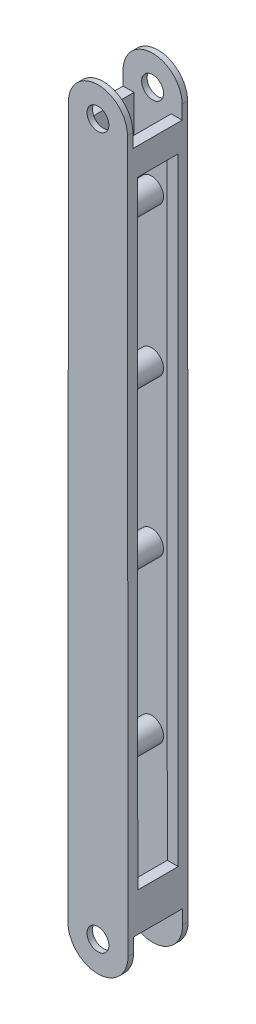
from build123d import *

# Parameters (mm, degrees)
SKETCH1_R               = 10
BOSS_EXTRUDE2_DEPTH     = 5
BOSS_EXTRUDE3_DEPTH     = 55
BOSS_EXTRUDE4_START     = 50
SKETCH1_4_R             = 10
BOSS_EXTRUDE4_DEPTH     = 5
CUT_EXTRUDE1_DEPTH      = 682.432576538
CUT_EXTRUDE1_DEPTH_BACK = 682.432576538
SKETCH3_W               = 37
SKETCH3_H               = 564.316545641
SKETCH4_R               = 11
BOSS_EXTRUDE5_DEPTH     = 49


with BuildPart() as part:
    # Sketch1 → Boss-Extrude2 (new body)
    with BuildSketch(Plane.XY):
        with BuildLine():
            Line((27.00967764, 637.419067567), (27, 650))
            ThreePointArc((27, 650), (11.628325989, 674.367643191), (-16.983854422, 670.989251749))
            ThreePointArc((-16.983854422, 670.989251749), (-24.367643191, 661.628325989), (-27, 650))
            Line((-27, 650), (-27.00967764, 637.419067567))
            Line((-27.00967764, 637.419067567), (-17.00967764, 637.419067567))
            Line((-17.00967764, 637.419067567), (-17.490017949, 12.976666451))
            Line((-17.490017949, 12.976666451), (-27.490017949, 12.976666451))
            Line((-27.490017949, 12.976666451), (-27.5, 0))
            ThreePointArc((-27.5, 0), (0, -27.5), (27.5, 0))
            Line((27.5, 0), (27.490017949, 12.976666451))
            Line((27.490017949, 12.976666451), (17.490017949, 12.976666451))
            Line((17.490017949, 12.976666451), (17.00967764, 637.419067567))
            Line((17.00967764, 637.419067567), (27.00967764, 637.419067567))
        make_face()
        Circle(SKETCH1_R, mode=Mode.SUBTRACT)
        with Locations((0, 650)):
            Circle(SKETCH1_R, mode=Mode.SUBTRACT)
    extrude(amount=BOSS_EXTRUDE2_DEPTH)

    # Sketch1<3> → Boss-Extrude3 (add)
    with BuildSketch(Plane.XY):
        Polygon((27.490017949, 12.976666451), (27.00967764, 637.419067567), (17.00967764, 637.419067567), (17.490017949, 12.976666451), align=None)
        Polygon((-17.00967764, 637.419067567), (-27.00967764, 637.419067567), (-27.490017949, 12.976666451), (-17.490017949, 12.976666451), align=None)
    extrude(amount=BOSS_EXTRUDE3_DEPTH)

    # Sketch1<4> → Boss-Extrude4 (add)
    with BuildSketch(Plane.XY.offset(BOSS_EXTRUDE4_START)):
        with BuildLine():
            Line((27.00967764, 637.419067567), (27, 650))
            ThreePointArc((27, 650), (11.628325989, 674.367643191), (-16.983854422, 670.989251749))
            ThreePointArc((-16.983854422, 670.989251749), (-24.367643191, 661.628325989), (-27, 650))
            Line((-27, 650), (-27.00967764, 637.419067567))
            Line((-27.00967764, 637.419067567), (-17.00967764, 637.419067567))
            Line((-17.00967764, 637.419067567), (-17.490017949, 12.976666451))
            Line((-17.490017949, 12.976666451), (-27.490017949, 12.976666451))
            Line((-27.490017949, 12.976666451), (-27.5, 0))
            ThreePointArc((-27.5, 0), (0, -27.5), (27.5, 0))
            Line((27.5, 0), (27.490017949, 12.976666451))
            Line((27.490017949, 12.976666451), (17.490017949, 12.976666451))
            Line((17.490017949, 12.976666451), (17.00967764, 637.419067567))
            Line((17.00967764, 637.419067567), (27.00967764, 637.419067567))
        make_face()
        Circle(SKETCH1_4_R, mode=Mode.SUBTRACT)
        with Locations((0, 650)):
            Circle(SKETCH1_4_R, mode=Mode.SUBTRACT)
    extrude(amount=BOSS_EXTRUDE4_DEPTH)

    # Sketch3 → Cut-Extrude1 (cut, two sides: drawn at the far end of the back side and taken through both)
    with BuildSketch(Plane(origin=(27.499983728, 0.021153834, 0), x_dir=(0, 0, -1), z_dir=(0.9999997041421432, 0.0007692305416477979, 0)).offset(-CUT_EXTRUDE1_DEPTH_BACK)):
        with Locations((-27.5, 330.399690719)):
            Rectangle(SKETCH3_W, SKETCH3_H)
    extrude(amount=CUT_EXTRUDE1_DEPTH + CUT_EXTRUDE1_DEPTH_BACK, mode=Mode.SUBTRACT)

    # Sketch4 → Boss-Extrude5 (add)
    with BuildSketch(Plane.XY.offset(55)):
        with Locations((0, 569.255461643)):
            Circle(SKETCH4_R)
        with Locations((0, 433.161322259)):
            Circle(SKETCH4_R)
        with Locations((0, 290.166334704)):
            Circle(SKETCH4_R)
        with Locations((0, 141.938836299)):
            Circle(SKETCH4_R)
    extrude(amount=-BOSS_EXTRUDE5_DEPTH)


solid = part.part
